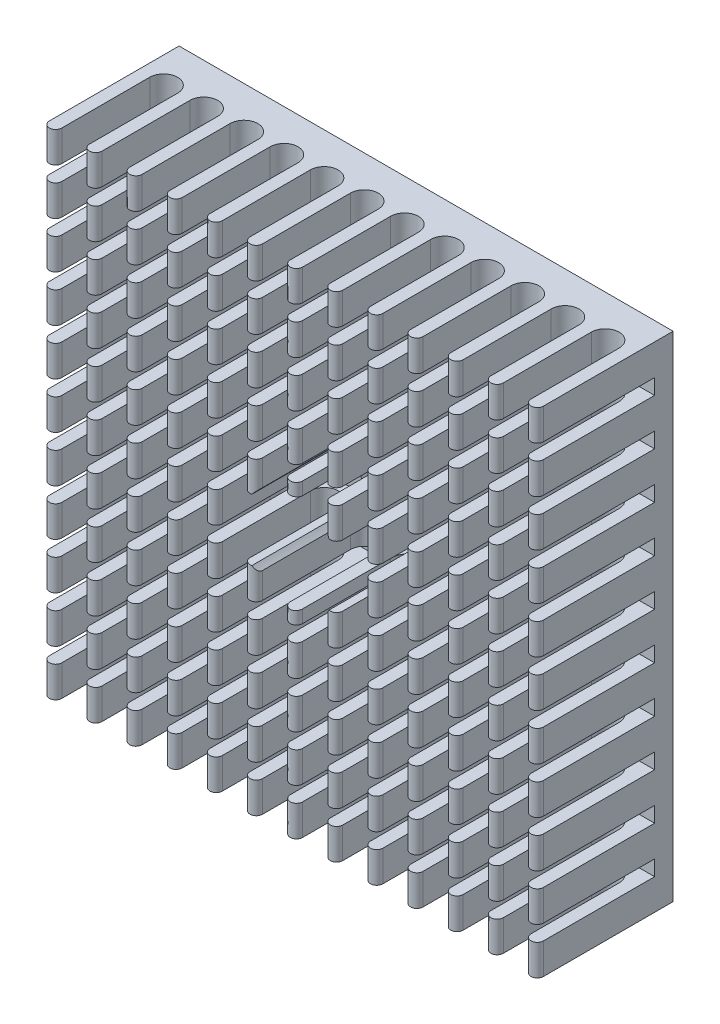
from build123d import *

# Parameters (mm, degrees)
BOSS_EXTRUDE2_DEPTH     = 20
CUT_EXTRUDE1_DEPTH      = 31.347982512
CUT_EXTRUDE1_DEPTH_BACK = 31.347982512
SKETCH3_W               = 11
SKETCH3_H               = 1.25
SKETCH6_R               = 4
CENTER_HOLE_DEPTH       = 31.347982512


with BuildPart() as part:
    # Sketch5 → Boss-Extrude2 (new, symmetric)
    with BuildSketch(Plane(origin=(0, 0, 0), x_dir=(1, 0, 0), z_dir=(0, 1, 0))):
        with BuildLine():
            Line((20, 0), (-20, 0))
            Line((-20, 0), (-20, -10.500001747))
            ThreePointArc((-20, -10.500001747), (-19.499999813, -11.000001934), (-18.999999626, -10.500001747))
            Line((-18.999999626, -10.500001747), (-18.999999626, -3.375000481))
            ThreePointArc((-18.999999626, -3.375000481), (-17.874999829, -2.250000683), (-16.750000031, -3.375000481))
            Line((-16.750000031, -3.375000481), (-16.750000031, -10.500001747))
            ThreePointArc((-16.750000031, -10.500001747), (-16.249999844, -11.000001934), (-15.749999657, -10.500001747))
            Line((-15.749999657, -10.500001747), (-15.749999657, -3.375000481))
            ThreePointArc((-15.749999657, -3.375000481), (-14.62499986, -2.250000683), (-13.500000062, -3.375000481))
            Line((-13.500000062, -3.375000481), (-13.500000062, -10.500001747))
            ThreePointArc((-13.500000062, -10.500001747), (-12.999999875, -11.000001934), (-12.499999689, -10.500001747))
            Line((-12.499999689, -10.500001747), (-12.499999689, -3.375000481))
            ThreePointArc((-12.499999689, -3.375000481), (-11.374999891, -2.250000683), (-10.250000093, -3.375000481))
            Line((-10.250000093, -3.375000481), (-10.250000093, -10.500001747))
            ThreePointArc((-10.250000093, -10.500001747), (-9.749999907, -11.000001934), (-9.24999972, -10.500001747))
            Line((-9.24999972, -10.500001747), (-9.24999972, -3.375000481))
            ThreePointArc((-9.24999972, -3.375000481), (-8.124999922, -2.250000683), (-7.000000125, -3.375000481))
            Line((-7.000000125, -3.375000481), (-7.000000125, -10.500001747))
            ThreePointArc((-7.000000125, -10.500001747), (-6.499999938, -11.000001934), (-5.999999751, -10.500001747))
            Line((-5.999999751, -10.500001747), (-5.999999751, -3.375000481))
            ThreePointArc((-5.999999751, -3.375000481), (-4.874999953, -2.250000683), (-3.750000156, -3.375000481))
            Line((-3.750000156, -3.375000481), (-3.750000156, -10.500001747))
            ThreePointArc((-3.750000156, -10.500001747), (-3.249999969, -11.000001934), (-2.749999782, -10.500001747))
            Line((-2.749999782, -10.500001747), (-2.749999782, -3.375000481))
            ThreePointArc((-2.749999782, -3.375000481), (-1.624999984, -2.250000683), (-0.500000187, -3.375000481))
            Line((-0.500000187, -3.375000481), (-0.500000187, -10.500001747))
            ThreePointArc((-0.500000187, -10.500001747), (0, -11.000001934), (0.500000187, -10.500001747))
            Line((0.500000187, -10.500001747), (0.500000187, -3.375000481))
            ThreePointArc((0.500000187, -3.375000481), (1.624999984, -2.250000683), (2.749999782, -3.375000481))
            Line((2.749999782, -3.375000481), (2.749999782, -10.500001747))
            ThreePointArc((2.749999782, -10.500001747), (3.249999969, -11.000001934), (3.750000156, -10.500001747))
            Line((3.750000156, -10.500001747), (3.750000156, -3.375000481))
            ThreePointArc((3.750000156, -3.375000481), (4.874999953, -2.250000683), (5.999999751, -3.375000481))
            Line((5.999999751, -3.375000481), (5.999999751, -10.500001747))
            ThreePointArc((5.999999751, -10.500001747), (6.499999938, -11.000001934), (7.000000125, -10.500001747))
            Line((7.000000125, -10.500001747), (7.000000125, -3.375000481))
            ThreePointArc((7.000000125, -3.375000481), (8.124999922, -2.250000683), (9.24999972, -3.375000481))
            Line((9.24999972, -3.375000481), (9.24999972, -10.500001747))
            ThreePointArc((9.24999972, -10.500001747), (9.749999907, -11.000001934), (10.250000093, -10.500001747))
            Line((10.250000093, -10.500001747), (10.250000093, -3.375000481))
            ThreePointArc((10.250000093, -3.375000481), (11.374999891, -2.250000683), (12.499999689, -3.375000481))
            Line((12.499999689, -3.375000481), (12.499999689, -10.500001747))
            ThreePointArc((12.499999689, -10.500001747), (12.999999875, -11.000001934), (13.500000062, -10.500001747))
            Line((13.500000062, -10.500001747), (13.500000062, -3.375000481))
            ThreePointArc((13.500000062, -3.375000481), (14.62499986, -2.250000683), (15.749999657, -3.375000481))
            Line((15.749999657, -3.375000481), (15.749999657, -10.500001747))
            ThreePointArc((15.749999657, -10.500001747), (16.249999844, -11.000001934), (16.750000031, -10.500001747))
            Line((16.750000031, -10.500001747), (16.750000031, -3.375000481))
            ThreePointArc((16.750000031, -3.375000481), (17.874999829, -2.250000683), (18.999999626, -3.375000481))
            Line((18.999999626, -3.375000481), (18.999999626, -10.500001747))
            ThreePointArc((18.999999626, -10.500001747), (19.499999813, -11.000001934), (20, -10.500001747))
            Line((20, -10.500001747), (20, 0))
        make_face()
    extrude(amount=BOSS_EXTRUDE2_DEPTH, both=True)

    # Sketch3 → Cut-Extrude1 (cut, two sides: drawn at the far end of the back side and taken through both)
    with BuildSketch(Plane(origin=(0, 0, 0), x_dir=(0, 0, -1), z_dir=(1, 0, 0)).offset(-CUT_EXTRUDE1_DEPTH_BACK)):
        with Locations((-7, 16.875)):
            Rectangle(SKETCH3_W, SKETCH3_H)
        with Locations((-7, 13.125)):
            Rectangle(SKETCH3_W, SKETCH3_H)
        with Locations((-7, 9.375)):
            Rectangle(SKETCH3_W, SKETCH3_H)
        with Locations((-7, 5.625)):
            Rectangle(SKETCH3_W, SKETCH3_H)
        with Locations((-7, 1.875)):
            Rectangle(SKETCH3_W, SKETCH3_H)
        with Locations((-7, -1.875)):
            Rectangle(SKETCH3_W, SKETCH3_H)
        with Locations((-7, -5.625)):
            Rectangle(SKETCH3_W, SKETCH3_H)
        with Locations((-7, -9.375)):
            Rectangle(SKETCH3_W, SKETCH3_H)
        with Locations((-7, -13.125)):
            Rectangle(SKETCH3_W, SKETCH3_H)
        with Locations((-7, -16.875)):
            Rectangle(SKETCH3_W, SKETCH3_H)
    extrude(amount=CUT_EXTRUDE1_DEPTH + CUT_EXTRUDE1_DEPTH_BACK, mode=Mode.SUBTRACT)

    # Sketch6 → Center Hole (cut, through all)
    with BuildSketch(Plane(origin=(0, 0, 0), x_dir=(-1, 0, 0), z_dir=(0, 0, -1))):
        Circle(SKETCH6_R)
    extrude(amount=-CENTER_HOLE_DEPTH, mode=Mode.SUBTRACT)


solid = part.part
